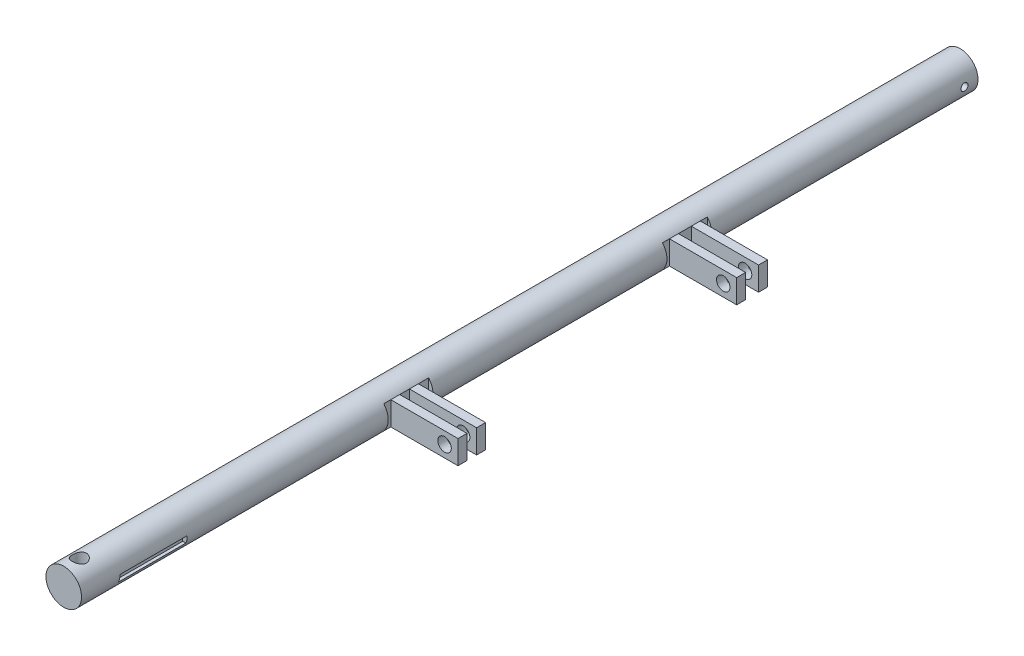
from build123d import *

# Parameters (mm, degrees)
CROQUIS1_R                 = 7.9375
SALIENTE_EXTRUIR1_DEPTH    = 200
CORTAR_EXTRUIR1_DEPTH      = 16.565810413
CORTAR_EXTRUIR1_DEPTH_BACK = 201.314771828
CROQUIS2_R                 = 1.5875
CORTAR_EXTRUIR2_DEPTH      = 201.314771936
CORTAR_EXTRUIR2_DEPTH_BACK = 16.77901512
CROQUIS3_R                 = 3.175
CROQUIS4_W                 = 20
CROQUIS4_H                 = 19.524905572
CROQUIS4_H_2               = 20.597317053
CROQUIS4_W_2               = 30
CROQUIS4_H_3               = 3.175
CORTAR_EXTRUIR3_DEPTH      = 2
CROQUIS5_W                 = 4
CROQUIS5_H                 = 10.535653752
SALIENTE_EXTRUIR2_DEPTH    = 30
CROQUIS6_R                 = 3
CORTAR_EXTRUIR4_DEPTH      = 232


with BuildPart() as part:
    # Croquis1 → Saliente-Extruir1 (new, symmetric)
    with BuildSketch(Plane.XY):
        Circle(CROQUIS1_R)
    extrude(amount=SALIENTE_EXTRUIR1_DEPTH, both=True)

    # Croquis2 → Cortar-Extruir1 (cut, two sides: drawn at the far end of the back side and taken through both)
    with BuildSketch(Plane(origin=(0, 0, 0), x_dir=(0, 0, -1), z_dir=(1, 0, 0)).offset(-CORTAR_EXTRUIR1_DEPTH_BACK)):
        with Locations((194, 0)):
            Circle(CROQUIS2_R)
    extrude(amount=CORTAR_EXTRUIR1_DEPTH + CORTAR_EXTRUIR1_DEPTH_BACK, mode=Mode.SUBTRACT)

    # Croquis3 → Cortar-Extruir2 (cut, two sides: drawn at the far end of the back side and taken through both)
    with BuildSketch(Plane(origin=(0, 0, 0), x_dir=(1, 0, 0), z_dir=(0, 1, 0)).offset(-CORTAR_EXTRUIR2_DEPTH_BACK)):
        with Locations((0, -193.067059354)):
            Circle(CROQUIS3_R)
    extrude(amount=CORTAR_EXTRUIR2_DEPTH + CORTAR_EXTRUIR2_DEPTH_BACK, mode=Mode.SUBTRACT)

    # Croquis4 → Cortar-Extruir3 (cut)
    with BuildSketch(Plane(origin=(7.9375, 0, 0), x_dir=(0, 0, -1), z_dir=(1, 0, 0))):
        with Locations((71.2, -0.983446493)):
            Rectangle(CROQUIS4_W, CROQUIS4_H)
        with Locations((-53.151122479, -1.451804467)):
            Rectangle(CROQUIS4_W, CROQUIS4_H_2)
        with Locations((-167.851453134, -1.451804466)):
            Rectangle(CROQUIS4_W_2, CROQUIS4_H_3)
    extrude(amount=-CORTAR_EXTRUIR3_DEPTH, mode=Mode.SUBTRACT)

    # Croquis5 → Saliente-Extruir2 (add)
    with BuildSketch(Plane(origin=(5.9375, 0, 0), x_dir=(0, 0, -1), z_dir=(1, 0, 0))):
        with Locations((66.325, 0)):
            Rectangle(CROQUIS5_W, CROQUIS5_H)
        with Locations((76.075, 0)):
            Rectangle(CROQUIS5_W, CROQUIS5_H)
        with Locations((-49.713622479, 0)):
            Rectangle(CROQUIS5_W, CROQUIS5_H)
        with Locations((-58.026122479, 0)):
            Rectangle(CROQUIS5_W, CROQUIS5_H)
    extrude(amount=SALIENTE_EXTRUIR2_DEPTH)

    # Croquis6 → Cortar-Extruir4 (cut)
    with BuildSketch(Plane(origin=(0, 0, -78.075), x_dir=(-1, 0, 0), z_dir=(0, 0, -1))):
        with Locations((-29.9375, 0)):
            Circle(CROQUIS6_R)
    extrude(amount=-CORTAR_EXTRUIR4_DEPTH, mode=Mode.SUBTRACT)


solid = part.part
